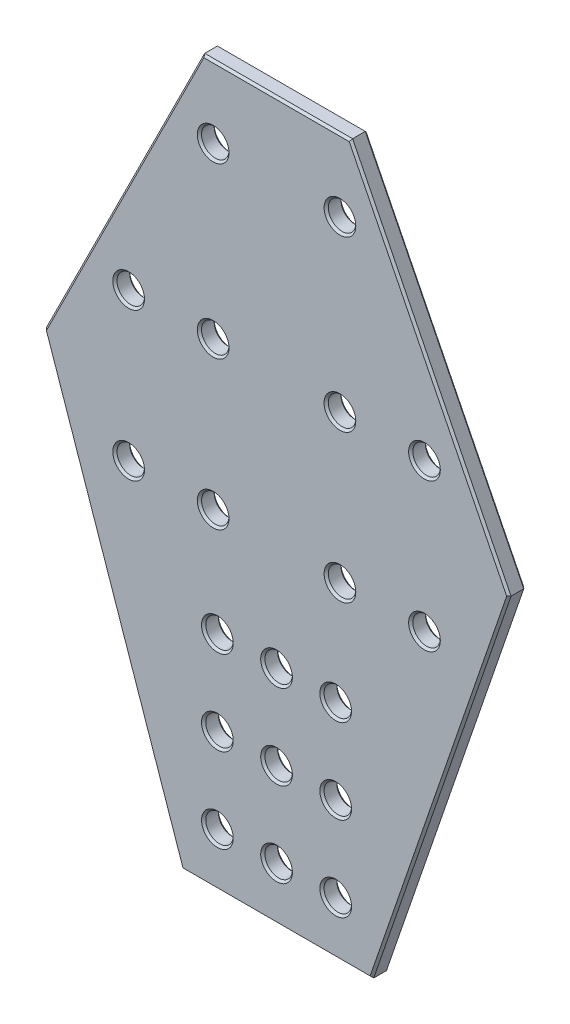
from build123d import *

# Parameters (mm, degrees)
SKETCH_1_R        = 13
EXTRUDE_869_DEPTH = 16
CHAMFER_1_SIZE    = 2


with BuildPart() as part:
    # 草图1 → Extrude 869 (new body)
    with BuildSketch(Plane.XY):
        Polygon((-70, 228), (70, 228), (220, -72), (90, -450), (-90, -450), (-220, -72), align=None)
        with Locations((-140, 0)):
            Circle(SKETCH_1_R, mode=Mode.SUBTRACT)
        with Locations((-60, 0)):
            Circle(SKETCH_1_R, mode=Mode.SUBTRACT)
        with Locations(Location((60, -140, 0), (0, 0, 180))):
            Circle(SKETCH_1_R, mode=Mode.SUBTRACT)
        with Locations(Location((140, -140, 0), (0, 0, 180))):
            Circle(SKETCH_1_R, mode=Mode.SUBTRACT)
        with Locations((-140, -140)):
            Circle(SKETCH_1_R, mode=Mode.SUBTRACT)
        with Locations((-60, -140)):
            Circle(SKETCH_1_R, mode=Mode.SUBTRACT)
        with Locations(Location((60, 0, 0), (0, 0, 180))):
            Circle(SKETCH_1_R, mode=Mode.SUBTRACT)
        with Locations(Location((140, 0, 0), (0, 0, 180))):
            Circle(SKETCH_1_R, mode=Mode.SUBTRACT)
        with Locations((0, -400)):
            Circle(SKETCH_1_R, mode=Mode.SUBTRACT)
        with Locations((0, -240)):
            Circle(SKETCH_1_R, mode=Mode.SUBTRACT)
        with Locations((60, 160)):
            Circle(SKETCH_1_R, mode=Mode.SUBTRACT)
        with Locations((0, -320)):
            Circle(SKETCH_1_R, mode=Mode.SUBTRACT)
        with Locations((-60, 160)):
            Circle(SKETCH_1_R, mode=Mode.SUBTRACT)
        with Locations((56, -240)):
            Circle(SKETCH_1_R, mode=Mode.SUBTRACT)
        with Locations((56, -320)):
            Circle(SKETCH_1_R, mode=Mode.SUBTRACT)
        with Locations((56, -400)):
            Circle(SKETCH_1_R, mode=Mode.SUBTRACT)
        with Locations(Location((-56, -400, 0), (0, 0, 180))):
            Circle(SKETCH_1_R, mode=Mode.SUBTRACT)
        with Locations(Location((-56, -320, 0), (0, 0, 180))):
            Circle(SKETCH_1_R, mode=Mode.SUBTRACT)
        with Locations(Location((-56, -240, 0), (0, 0, 180))):
            Circle(SKETCH_1_R, mode=Mode.SUBTRACT)
    extrude(amount=EXTRUDE_869_DEPTH)

    # 倒角1
    chamfer_1_edges = [part.edges().sort_by_distance(p)[0] for p in [
        (0, -450, 16),
        (155, -261, 16),
        (145, 78, 16),
        (-153, 0, 0),
        (-153, 0, 16),
        (0, 228, 16),
        (-73, 0, 0),
        (-73, 0, 16),
        (73, -140, 0),
        (73, -140, 16),
        (153, -140, 0),
        (153, -140, 16),
        (-153, -140, 0),
        (-153, -140, 16),
        (-73, -140, 0),
        (-73, -140, 16),
        (73, 0, 0),
        (73, 0, 16),
        (-145, 78, 16),
        (153, 0, 0),
        (153, 0, 16),
        (-13, -400, 0),
        (-13, -400, 16),
        (-13, -240, 0),
        (-13, -240, 16),
        (-13, -320, 0),
        (-13, -320, 16),
        (47, 160, 0),
        (47, 160, 16),
        (0, 228, 0),
        (-73, 160, 0),
        (-73, 160, 16),
        (145, 78, 0),
        (43, -240, 0),
        (43, -240, 16),
        (155, -261, 0),
        (43, -320, 0),
        (43, -320, 16),
        (-155, -261, 16),
        (0, -450, 0),
        (43, -400, 0),
        (43, -400, 16),
        (-155, -261, 0),
        (-43, -400, 0),
        (-43, -400, 16),
        (-145, 78, 0),
        (-43, -320, 0),
        (-43, -320, 16),
        (-43, -240, 0),
        (-43, -240, 16),
    ]]
    chamfer(chamfer_1_edges, length=CHAMFER_1_SIZE)


solid = part.part
